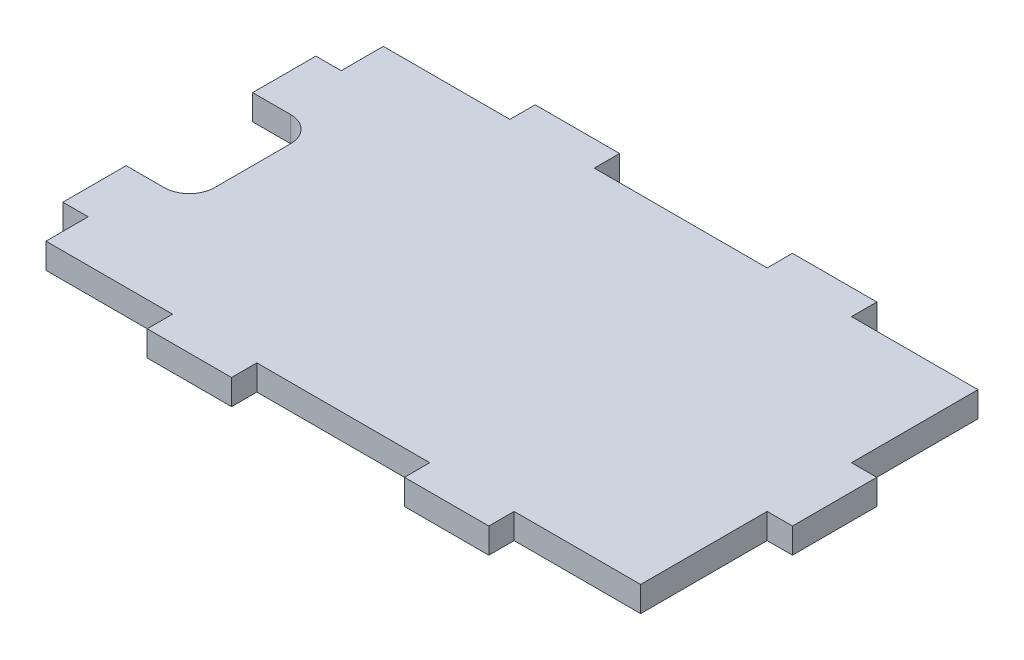
from build123d import *

# Parameters (mm, degrees)
SKETCH1_W           = 141
SKETCH1_H           = 80
BOSS_EXTRUDE1_DEPTH = 6
SKETCH2_W           = 20
SKETCH2_H           = 6
BOSS_EXTRUDE2_DEPTH = 6
SKETCH3_W           = 20
SKETCH3_H           = 6
BOSS_EXTRUDE3_DEPTH = 6
SKETCH4_W           = 15
SKETCH4_H           = 6
BOSS_EXTRUDE4_DEPTH = 6
SKETCH5_W           = 20
SKETCH5_H           = 6
BOSS_EXTRUDE5_DEPTH = 6
CUT_EXTRUDE1_DEPTH  = 6


with BuildPart() as part:
    # Sketch1 → Boss-Extrude1 (new body)
    with BuildSketch(Plane(origin=(0, 0, 0), x_dir=(1, 0, 0), z_dir=(0, 1, 0))):
        with Locations((70.5, -40)):
            Rectangle(SKETCH1_W, SKETCH1_H)
    extrude(amount=BOSS_EXTRUDE1_DEPTH)

    # Sketch2 → Boss-Extrude2 (add)
    with BuildSketch(Plane.XY.offset(80)):
        with Locations((40, 3)):
            Rectangle(SKETCH2_W, SKETCH2_H)
        with Locations((101, 3)):
            Rectangle(SKETCH2_W, SKETCH2_H)
    extrude(amount=BOSS_EXTRUDE2_DEPTH)

    # Sketch3 → Boss-Extrude3 (add)
    with BuildSketch(Plane(origin=(0, 0, 0), x_dir=(-1, 0, 0), z_dir=(0, 0, -1))):
        with Locations((-101, 3)):
            Rectangle(SKETCH3_W, SKETCH3_H)
        with Locations((-40, 3)):
            Rectangle(SKETCH3_W, SKETCH3_H)
    extrude(amount=BOSS_EXTRUDE3_DEPTH)

    # Sketch4 → Boss-Extrude4 (add)
    with BuildSketch(Plane.ZY):
        with Locations((17.5, 3)):
            Rectangle(SKETCH4_W, SKETCH4_H)
        with Locations((62.5, 3)):
            Rectangle(SKETCH4_W, SKETCH4_H)
    extrude(amount=BOSS_EXTRUDE4_DEPTH)

    # Sketch5 → Boss-Extrude5 (add)
    with BuildSketch(Plane(origin=(141, 0, 0), x_dir=(0, 0, -1), z_dir=(1, 0, 0))):
        with Locations((-40, 3)):
            Rectangle(SKETCH5_W, SKETCH5_H)
    extrude(amount=BOSS_EXTRUDE5_DEPTH)

    # Sketch6 → Cut-Extrude1 (cut)
    with BuildSketch(Plane(origin=(0, 6, 0), x_dir=(1, 0, 0), z_dir=(0, 1, 0))):
        with BuildLine():
            Line((0, -25), (3, -25))
            ThreePointArc((3, -25), (7.242640687, -26.757359313), (9, -31))
            Line((9, -31), (9, -49))
            ThreePointArc((9, -49), (7.242640687, -53.242640687), (3, -55))
            Line((3, -55), (0, -55))
            Line((0, -55), (0, -25))
        make_face()
    extrude(amount=-CUT_EXTRUDE1_DEPTH, mode=Mode.SUBTRACT)


solid = part.part
